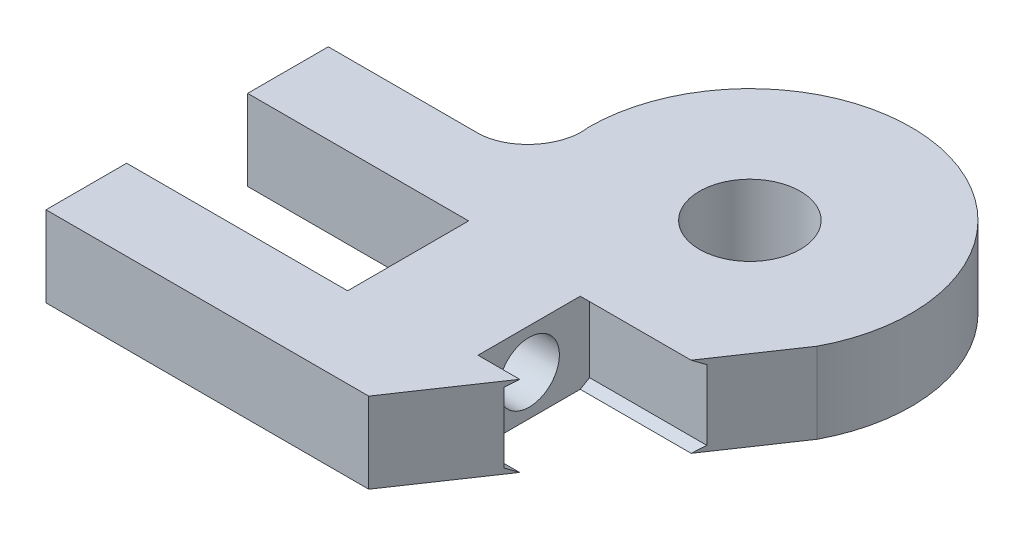
from build123d import *

# Parameters (mm, degrees)
SKETCH1_R               = 2.5
BOSS_EXTRUDE1_DEPTH     = 4
CUT_EXTRUDE1_DEPTH      = 23.69985803
CUT_EXTRUDE1_DEPTH_BACK = 23.69985803
SKETCH2_R               = 1.5
CUT_EXTRUDE2_START      = -6
SKETCH2_3_R             = 1.5
CUT_EXTRUDE2_DEPTH      = 17.69985803


with BuildPart() as part:
    # Sketch1 → Boss-Extrude1 (new body)
    with BuildSketch(Plane(origin=(0, 0, 0), x_dir=(1, 0, 0), z_dir=(0, 1, 0))):
        with BuildLine():
            Line((-3.917235504, 5.608829899), (-11.340461202, 5.608829899))
            Line((-11.340461202, 5.608829899), (-11.340461202, 1.608829899))
            Line((-11.340461202, 1.608829899), (-0.381690636, 1.608829899))
            Line((-0.381690636, 1.608829899), (-0.381690636, -4.391170101))
            Line((-0.381690636, -4.391170101), (-11.340461202, -4.391170101))
            Line((-11.340461202, -4.391170101), (-11.340461202, -8.391170101))
            Line((-11.340461202, -8.391170101), (4.664608782, -8.391170101))
            Line((4.664608782, -8.391170101), (13.638576545, 4.87022374))
            ThreePointArc((13.638576545, 4.87022374), (8.491842548, 16.373540203), (-1.434104983, 8.608829899))
            add(Edge.make_bspline(
                [(-1.434104983, 8.608829899), (-1.198427894, 7.122985203), (-2.407634222, 5.627246583), (-3.917235504, 5.608829899)],
                knots=[0.869474373, 0.869474373, 0.869474373, 0.869474373, 1.869474373, 1.869474373, 1.869474373, 1.869474373], degree=3))
        make_face()
        with Locations(Location((6.565895017, 8.608829899, 0), (0, 0, 270))):
            Circle(SKETCH1_R, mode=Mode.SUBTRACT)
    extrude(amount=BOSS_EXTRUDE1_DEPTH)

    # Sketch2 → Cut-Extrude1 (cut, two sides: drawn at the far end of the back side and taken through both)
    with BuildSketch(Plane.ZY.offset(0.381690636).offset(-CUT_EXTRUDE1_DEPTH_BACK)):
        with Locations((1.391170101, 2)):
            Circle(SKETCH2_R)
    extrude(amount=CUT_EXTRUDE1_DEPTH + CUT_EXTRUDE1_DEPTH_BACK, mode=Mode.SUBTRACT)

    # Sketch2<3> → Cut-Extrude2 (cut, through all)
    with BuildSketch(Plane.ZY.offset(0.381690636).offset(CUT_EXTRUDE2_START)):
        Polygon((-1.608829899, 3.732050808), (-1.608829899, 0.267949192), (1.391170101, -1.464101615), (4.391170101, 0.267949192), (4.391170101, 3.732050808), (1.391170101, 5.464101615), align=None)
        with Locations((1.391170101, 2)):
            Circle(SKETCH2_3_R, mode=Mode.SUBTRACT)
    extrude(amount=-CUT_EXTRUDE2_DEPTH, mode=Mode.SUBTRACT)


solid = part.part
